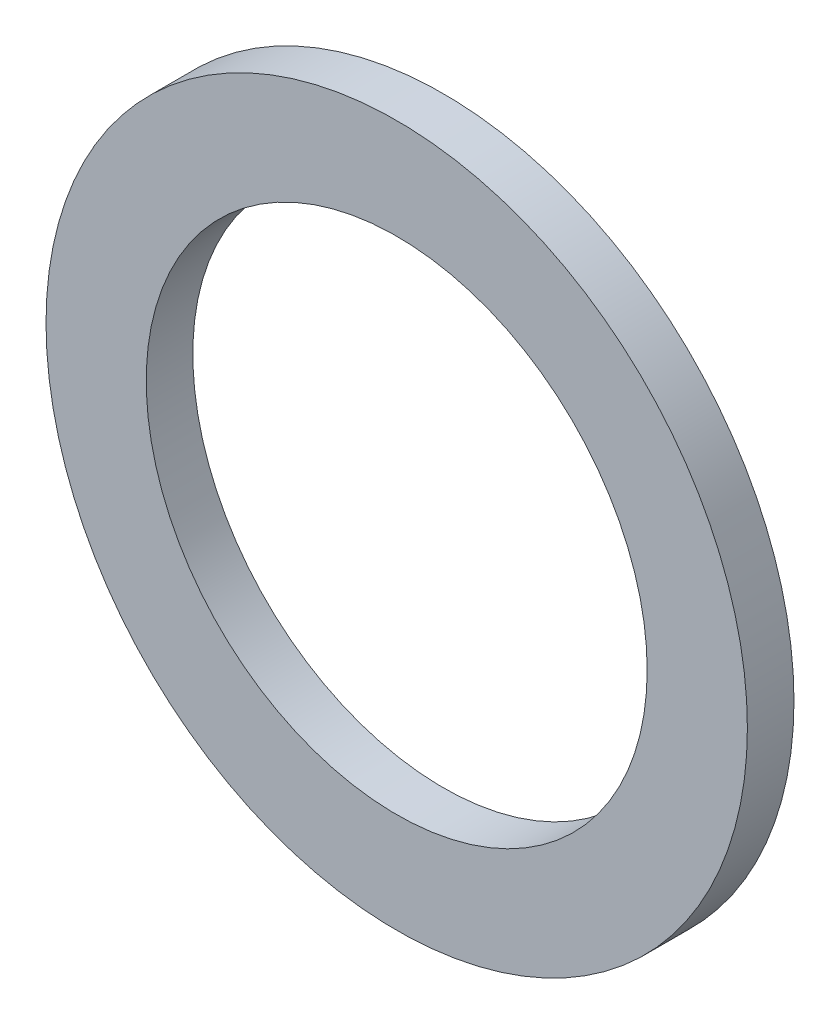
from build123d import *

# Parameters (mm, degrees)
SKETCH1_R           = 7
SKETCH1_R_2         = 5
BOSS_EXTRUDE1_DEPTH = 0.93


with BuildPart() as part:
    # Sketch1 → Boss-Extrude1 (new body)
    with BuildSketch(Plane.XY):
        Circle(SKETCH1_R)
        Circle(SKETCH1_R_2, mode=Mode.SUBTRACT)
    extrude(amount=BOSS_EXTRUDE1_DEPTH)


solid = part.part
